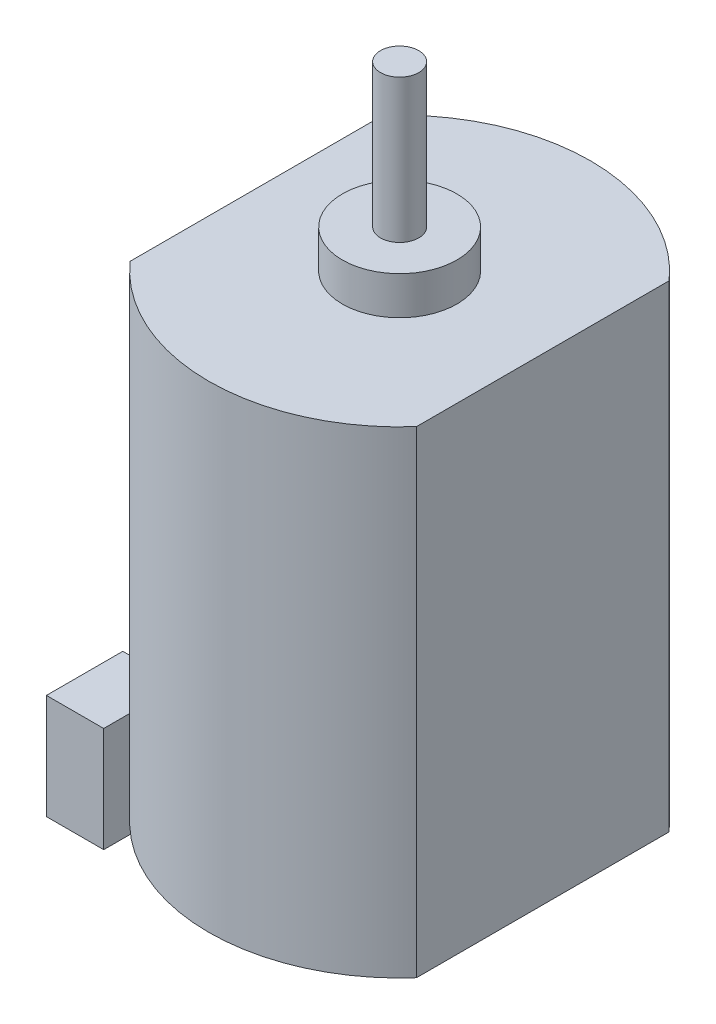
from build123d import *

# Parameters (mm, degrees)
SKETCH_1_R            = 10
EXTRUDE_1_DEPTH       = 25
CUT_EXTRUDE_2_1_REACH = 30.723
SKETCH_2_W            = 2.5
SKETCH_2_H            = 20
SKETCH_3_R            = 3
EXTRUDE_2_DEPTH       = 2
EXTRUDE_START         = -2
SKETCH_4_R            = 1
EXTRUDE_3_DEPTH       = 9.5
EXTRUDE_START_2       = -25
EXTRUDE_4_DEPTH       = 27.3
EXTRUDE_START_3       = 1
SKETCH_6_R            = 1
EXTRUDE_5_DEPTH       = 1
EXTRUDE_6_DEPTH       = 3


with BuildPart() as part:
    # 草图1 → 圆柱凸台-拉伸1 (new body)
    with BuildSketch(Plane(origin=(0, 0, 0), x_dir=(1, 0, 0), z_dir=(0, 1, 0))):
        with Locations(Location((0, 0, 0), (0, 0, 270))):
            Circle(SKETCH_1_R)
    extrude(amount=EXTRUDE_1_DEPTH)

    # 草图2 → 2边切除切除-拉伸1 (cut, up to next)
    with BuildSketch(Plane.XZ, mode=Mode.PRIVATE) as cut_extrude_2_1_sk1:
        with Locations((-8.75, 0)):
            Rectangle(SKETCH_2_W, SKETCH_2_H)
    cut_extrude_2_1_tool1 = extrude(cut_extrude_2_1_sk1.sketch, amount=-CUT_EXTRUDE_2_1_REACH, mode=Mode.PRIVATE) & part.part
    # 草图2 → 2边切除切除-拉伸1 (cut, up to next)
    with BuildSketch(Plane.XZ, mode=Mode.PRIVATE) as cut_extrude_2_1_sk2:
        with Locations((8.75, 0)):
            Rectangle(SKETCH_2_W, SKETCH_2_H)
    cut_extrude_2_1_tool2 = extrude(cut_extrude_2_1_sk2.sketch, amount=-CUT_EXTRUDE_2_1_REACH, mode=Mode.PRIVATE) & part.part
    add(cut_extrude_2_1_tool1.solids().sort_by_distance((-8.75, 0, 0))[0], mode=Mode.SUBTRACT)
    add(cut_extrude_2_1_tool2.solids().sort_by_distance((8.75, 0, 0))[0], mode=Mode.SUBTRACT)

    # 草图3 → 前转凸台-拉伸2 (add)
    with BuildSketch(Plane(origin=(0, 25, 0), x_dir=(1, 0, 0), z_dir=(0, 1, 0))):
        with Locations(Location((0, 0, 0), (0, 0, 270))):
            Circle(SKETCH_3_R)
    extrude(amount=EXTRUDE_2_DEPTH)

    # 草图4 → 前转杆凸台-拉伸3 (add)
    with BuildSketch(Plane(origin=(0, 27, 0), x_dir=(1, 0, 0), z_dir=(0, 1, 0)).offset(EXTRUDE_START)):
        with Locations(Location((0, 0, 0), (0, 0, 270))):
            Circle(SKETCH_4_R)
    extrude(amount=EXTRUDE_3_DEPTH)

    # 草图5 → 后转凸台-拉伸4 (add)
    with BuildSketch(Plane.XZ.offset(EXTRUDE_START_2)):
        with BuildLine():
            Line((4, 3), (4, -3))
            ThreePointArc((4, -3), (-5, 0), (4, 3))
        make_face()
    extrude(amount=EXTRUDE_4_DEPTH)

    # 草图6 → 后转杆凸台-拉伸5 (add)
    with BuildSketch(Plane.XZ.offset(2.3).offset(EXTRUDE_START_3)):
        with Locations(Location((0, 0, 0), (0, 0, 90))):
            Circle(SKETCH_6_R)
    extrude(amount=-EXTRUDE_5_DEPTH)

    # 草图7 → 引线凸台-拉伸6 (add)
    with BuildSketch(Plane.ZY.offset(7.5)):
        Polygon((-8, 3), (-8, 4.5), (-4, 4.5), (-4, 3), (-4, -1), (-8, -1), align=None)
        Polygon((8, 3), (8, -1), (4, -1), (4, 3), (4, 4.5), (8, 4.5), align=None)
    extrude(amount=EXTRUDE_6_DEPTH)


solid = part.part
